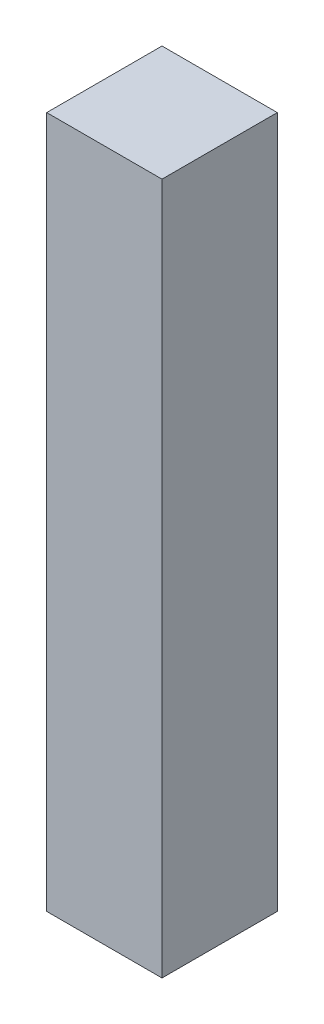
from build123d import *

# Parameters (mm, degrees)
SKETCH1_W           = 101.6
SKETCH1_H           = 101.6
BOSS_EXTRUDE1_DEPTH = 609.6


with BuildPart() as part:
    # Sketch1 → Boss-Extrude1 (new body)
    with BuildSketch(Plane(origin=(0, 0, 0), x_dir=(1, 0, 0), z_dir=(0, 1, 0))):
        Rectangle(SKETCH1_W, SKETCH1_H)
    extrude(amount=BOSS_EXTRUDE1_DEPTH)


solid = part.part
